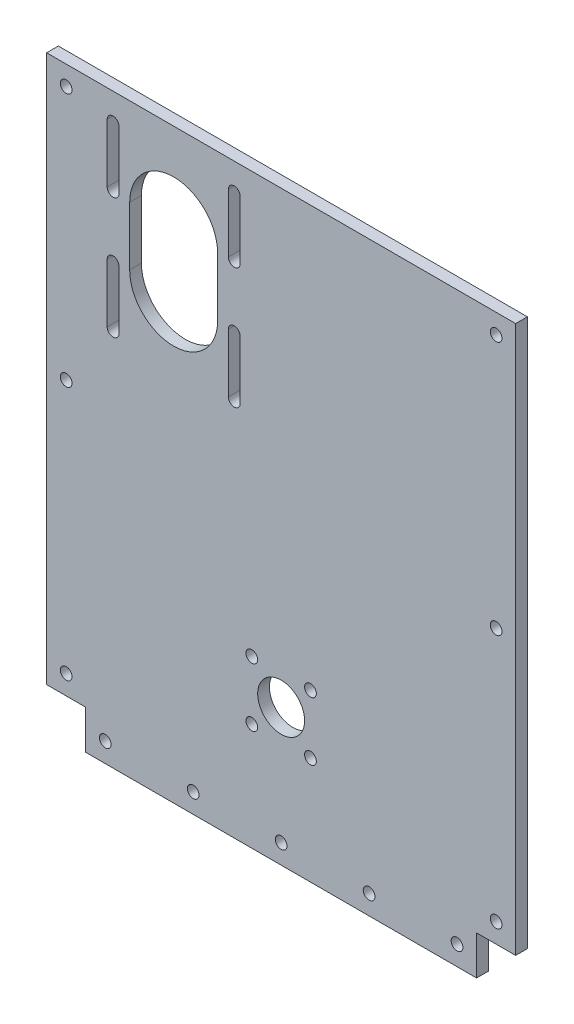
from build123d import *

# Parameters (mm, degrees)
BOSS_EXTRU_1_DEPTH      = 3
ESQUISSE2_R             = 1.5
ENL_V_MAT_EXTRU_2_DEPTH = 3
ESQUISSE3_R             = 6
ESQUISSE3_R_2           = 1.5
ENL_V_MAT_EXTRU_3_DEPTH = 10


with BuildPart() as part:
    # Esquisse1 → Boss.-Extru.1 (new body)
    with BuildSketch(Plane.XY):
        Polygon((-50, -75), (50, -75), (50, -65), (60, -65), (60, 75), (-60, 75), (-60, -65), (-50, -65), align=None)
        with BuildLine():
            ThreePointArc((-41.5, 22), (-43, 20.5), (-44.5, 22))
            Line((-44.5, 22), (-44.5, 37))
            ThreePointArc((-44.5, 37), (-43, 38.5), (-41.5, 37))
            Line((-41.5, 37), (-41.5, 22))
        make_face(mode=Mode.SUBTRACT)
        with BuildLine():
            Line((-10.5, 37), (-10.5, 22))
            ThreePointArc((-10.5, 22), (-12, 20.5), (-13.5, 22))
            Line((-13.5, 22), (-13.5, 37))
            ThreePointArc((-13.5, 37), (-12, 38.5), (-10.5, 37))
        make_face(mode=Mode.SUBTRACT)
        with BuildLine():
            ThreePointArc((-41.5, 53), (-43, 51.5), (-44.5, 53))
            Line((-44.5, 53), (-44.5, 68))
            ThreePointArc((-44.5, 68), (-43, 69.5), (-41.5, 68))
            Line((-41.5, 68), (-41.5, 53))
        make_face(mode=Mode.SUBTRACT)
        with BuildLine():
            ThreePointArc((-16.25, 37.5), (-27.5, 26.25), (-38.75, 37.5))
            Line((-38.75, 37.5), (-38.75, 52.5))
            ThreePointArc((-38.75, 52.5), (-27.5, 63.75), (-16.25, 52.5))
            Line((-16.25, 52.5), (-16.25, 37.5))
        make_face(mode=Mode.SUBTRACT)
        with BuildLine():
            Line((-10.5, 68), (-10.5, 53))
            ThreePointArc((-10.5, 53), (-12, 51.5), (-13.5, 53))
            Line((-13.5, 53), (-13.5, 68))
            ThreePointArc((-13.5, 68), (-12, 69.5), (-10.5, 68))
        make_face(mode=Mode.SUBTRACT)
    extrude(amount=BOSS_EXTRU_1_DEPTH)

    # Esquisse2 → Enlèv. mat.-Extru.2 (cut)
    with BuildSketch(Plane.XY.offset(3)):
        with Locations((45, -70)):
            Circle(ESQUISSE2_R)
        with Locations((-55, -60)):
            Circle(ESQUISSE2_R)
        with Locations((-55, 5)):
            Circle(ESQUISSE2_R)
        with Locations((-55, 70)):
            Circle(ESQUISSE2_R)
        with Locations((22.5, -70)):
            Circle(ESQUISSE2_R)
        with Locations((0, -70)):
            Circle(ESQUISSE2_R)
        with Locations((-22.5, -70)):
            Circle(ESQUISSE2_R)
        with Locations((-45, -70)):
            Circle(ESQUISSE2_R)
        with Locations(Location((55, -60, 0), (0, 0, 180))):
            Circle(ESQUISSE2_R)
        with Locations(Location((55, 5, 0), (0, 0, 180))):
            Circle(ESQUISSE2_R)
        with Locations(Location((55, 70, 0), (0, 0, 180))):
            Circle(ESQUISSE2_R)
    extrude(amount=-ENL_V_MAT_EXTRU_2_DEPTH, mode=Mode.SUBTRACT)

    # Esquisse3 → Enlèv. mat.-Extru.3 (cut)
    with BuildSketch(Plane.XY.offset(3)):
        with Locations((0, -40)):
            Circle(ESQUISSE3_R)
        with Locations((-7.5, -32.5)):
            Circle(ESQUISSE3_R_2)
        with Locations((7.5, -32.5)):
            Circle(ESQUISSE3_R_2)
        with Locations((7.5, -47.5)):
            Circle(ESQUISSE3_R_2)
        with Locations((-7.5, -47.5)):
            Circle(ESQUISSE3_R_2)
    extrude(amount=-ENL_V_MAT_EXTRU_3_DEPTH, mode=Mode.SUBTRACT)


solid = part.part
